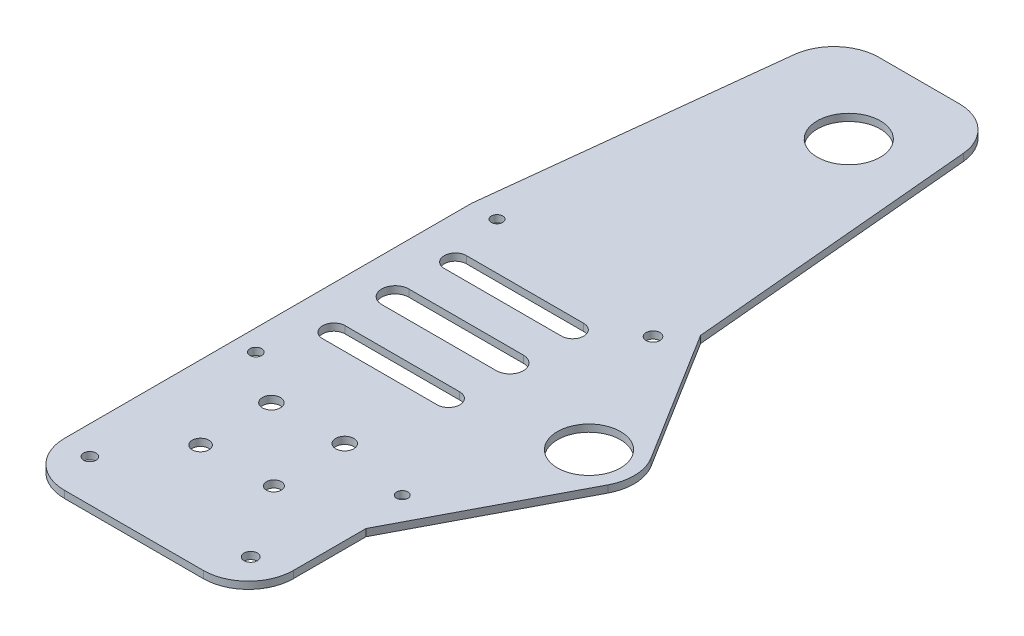
from build123d import *

# Parameters (mm, degrees)
SKETCH1_R           = 1.388229101
SKETCH1_R_2         = 1.314910669
SKETCH1_R_3         = 1.856429035
SKETCH1_R_4         = 2
SKETCH1_R_5         = 1.65
SKETCH1_R_6         = 1.483383261
SKETCH1_R_7         = 1.248623853
SKETCH1_R_8         = 1.255629307
SKETCH1_R_9         = 7
SKETCH1_R_10        = 1.53911217
BOSS_EXTRUDE1_DEPTH = 1.5875
SKETCH4_W           = 66.272407177
SKETCH4_H           = 27.800260981
CUT_EXTRUDE2_DEPTH  = 20
FILLET3_R           = 10
FILLET4_R           = 10
BOSS_EXTRUDE3_START = -1.5875
BOSS_EXTRUDE3_DEPTH = 1.5875
SKETCH7_R           = 7
CUT_EXTRUDE3_DEPTH  = 1.5875
SKETCH8_W           = 100.106183873
SKETCH8_H           = 60.21728362
CUT_EXTRUDE4_DEPTH  = 35
FILLET5_R           = 10


with BuildPart() as part:
    # Sketch1 → Boss-Extrude1 (new body)
    with BuildSketch(Plane(origin=(0, 0, 0), x_dir=(1, 0, 0), z_dir=(0, 1, 0))):
        with BuildLine():
            Line((42.32729629, 228.6), (10.454309325, 228.6))
            Line((10.454309325, 228.6), (0, 135.362739137))
            Line((0, 135.362739137), (0, 0))
            Line((0, 0), (24.327009544, 0))
            Line((24.327009544, 0), (50.8, 0))
            Line((50.8, 0), (50.8, 64.87909603))
            Line((50.8, 64.87909603), (50.8, 87.423477361))
            Line((50.8, 87.423477361), (50.8, 98.200996728))
            ThreePointArc((50.8, 98.200996728), (50.4, 101.000996728), (50.8, 103.800996728))
            Line((50.8, 103.800996728), (50.8, 104.488200565))
            Line((50.8, 104.488200565), (50.8, 120.619222808))
            Line((50.8, 120.619222808), (50.8, 135.362739137))
            Line((50.8, 135.362739137), (42.32729629, 228.6))
        make_face()
        with Locations(Location((6.335590122, 44.288799513, 0), (0, 0, 270))):
            Circle(SKETCH1_R, mode=Mode.SUBTRACT)
        with Locations(Location((4.659546827, 82.793173401, 0), (0, 0, 270))):
            Circle(SKETCH1_R_2, mode=Mode.SUBTRACT)
        with Locations(Location((16.389129236, 58.804246097, 0), (0, 0, 270))):
            Circle(SKETCH1_R_3, mode=Mode.SUBTRACT)
        with Locations(Location((16.113249369, 74.801867492, 0), (0, 0, 270))):
            Circle(SKETCH1_R_4, mode=Mode.SUBTRACT)
        with Locations(Location((32.386750631, 59.080125965, 0), (0, 0, 270))):
            Circle(SKETCH1_R_5, mode=Mode.SUBTRACT)
        with Locations(Location((32.110870764, 75.07774736, 0), (0, 0, 270))):
            Circle(SKETCH1_R_4, mode=Mode.SUBTRACT)
        with BuildLine():
            Line((34.925740903, 92.78493524), (9.492033273, 92.78493524))
            ThreePointArc((9.492033273, 92.78493524), (6.992033273, 95.28493524), (9.492033273, 97.78493524))
            Line((9.492033273, 97.78493524), (34.925740903, 97.78493524))
            ThreePointArc((34.925740903, 97.78493524), (36.693507856, 97.052702193), (37.425740903, 95.28493524))
            ThreePointArc((37.425740903, 95.28493524), (36.693507856, 93.517168287), (34.925740903, 92.78493524))
        make_face(mode=Mode.SUBTRACT)
        with BuildLine():
            Line((34.925740903, 105.90993524), (9.492033273, 105.90993524))
            ThreePointArc((9.492033273, 105.90993524), (6.492033273, 108.90993524), (9.492033273, 111.90993524))
            Line((9.492033273, 111.90993524), (34.925740903, 111.90993524))
            ThreePointArc((34.925740903, 111.90993524), (37.047061246, 111.031255584), (37.925740903, 108.90993524))
            ThreePointArc((37.925740903, 108.90993524), (37.047061246, 106.788614896), (34.925740903, 105.90993524))
        make_face(mode=Mode.SUBTRACT)
        with Locations(Location((43.447673368, 42.868436544, 0), (0, 0, 270))):
            Circle(SKETCH1_R_6, mode=Mode.SUBTRACT)
        with Locations(Location((48.400988852, 71.551011715, 0), (0, 0, 270))):
            Circle(SKETCH1_R_7, mode=Mode.SUBTRACT)
        with Locations(Location((5.88467603, 135.103145298, 0), (0, 0, 270))):
            Circle(SKETCH1_R_8, mode=Mode.SUBTRACT)
        with BuildLine():
            Line((35.509675341, 119.784935244), (9.492033273, 119.784935244))
            ThreePointArc((9.492033273, 119.784935244), (7.026609419, 122.250359097), (9.492033273, 124.71578295))
            Line((9.492033273, 124.71578295), (35.509675341, 124.71578295))
            ThreePointArc((35.509675341, 124.71578295), (37.252993266, 123.993677022), (37.975099194, 122.250359097))
            ThreePointArc((37.975099194, 122.250359097), (37.252993266, 120.507041172), (35.509675341, 119.784935244))
        make_face(mode=Mode.SUBTRACT)
        with Locations(Location((29.504213454, 189.557234372, 0), (0, 0, 270))):
            Circle(SKETCH1_R_9, mode=Mode.SUBTRACT)
        with Locations(Location((45.747747887, 129.863467374, 0), (0, 0, 270))):
            Circle(SKETCH1_R_10, mode=Mode.SUBTRACT)
    extrude(amount=BOSS_EXTRUDE1_DEPTH)

    # Sketch4 → Cut-Extrude2 (cut)
    with BuildSketch(Plane(origin=(0, 0, -228.6), x_dir=(-1, 0, 0), z_dir=(0, 0, -1))):
        with Locations((-28.174690156, -1.980940155)):
            Rectangle(SKETCH4_W, SKETCH4_H)
    extrude(amount=-CUT_EXTRUDE2_DEPTH, mode=Mode.SUBTRACT)

    # Fillet3
    fillet3_edges = [part.edges().sort_by_distance(p)[0] for p in [
        (44.144746445, 0.79375, -208.6),
    ]]
    fillet(fillet3_edges, radius=FILLET3_R)

    # Fillet4
    fillet4_edges = [part.edges().sort_by_distance(p)[0] for p in [
        (50.8, 0.79375, 0),
        (0, 0.79375, 0),
        (8.211791854, 0.79375, -208.6),
    ]]
    fillet(fillet4_edges, radius=FILLET4_R)

    # Sketch6 → Boss-Extrude3 (add)
    with BuildSketch(Plane(origin=(0, 1.5875, 0), x_dir=(1, 0, 0), z_dir=(0, 1, 0)).offset(BOSS_EXTRUDE3_START)):
        with BuildLine():
            Line((50.8, 135.362739137), (50.8, 103.800996728))
            ThreePointArc((50.8, 103.800996728), (50.4, 101.000996728), (50.8, 98.200996728))
            Line((50.8, 98.200996728), (50.8, 61.124243317))
            Line((50.8, 61.124243317), (69.258211507, 96.360728536))
            ThreePointArc((69.258211507, 96.360728536), (70.393157133, 101.370875786), (68.890940865, 106.283413148))
            Line((68.890940865, 106.283413148), (50.8, 135.362739137))
        make_face()
    extrude(amount=BOSS_EXTRUDE3_DEPTH)

    # Sketch7 → Cut-Extrude3 (cut)
    with BuildSketch(Plane(origin=(0, 1.5875, 0), x_dir=(1, 0, 0), z_dir=(0, 1, 0))):
        with Locations(Location((60.4, 101.000996728, 0), (0, 0, 270))):
            Circle(SKETCH7_R)
    extrude(amount=-CUT_EXTRUDE3_DEPTH, mode=Mode.SUBTRACT)

    # Sketch8 → Cut-Extrude4 (cut)
    with BuildSketch(Plane.XY):
        with Locations((28.455154517, 1.704032249)):
            Rectangle(SKETCH8_W, SKETCH8_H)
    extrude(amount=-CUT_EXTRUDE4_DEPTH, mode=Mode.SUBTRACT)

    # Fillet5
    fillet5_edges = [part.edges().sort_by_distance(p)[0] for p in [
        (0, 0.79375, -35),
        (50.8, 0.79375, -35),
    ]]
    fillet(fillet5_edges, radius=FILLET5_R)


solid = part.part
